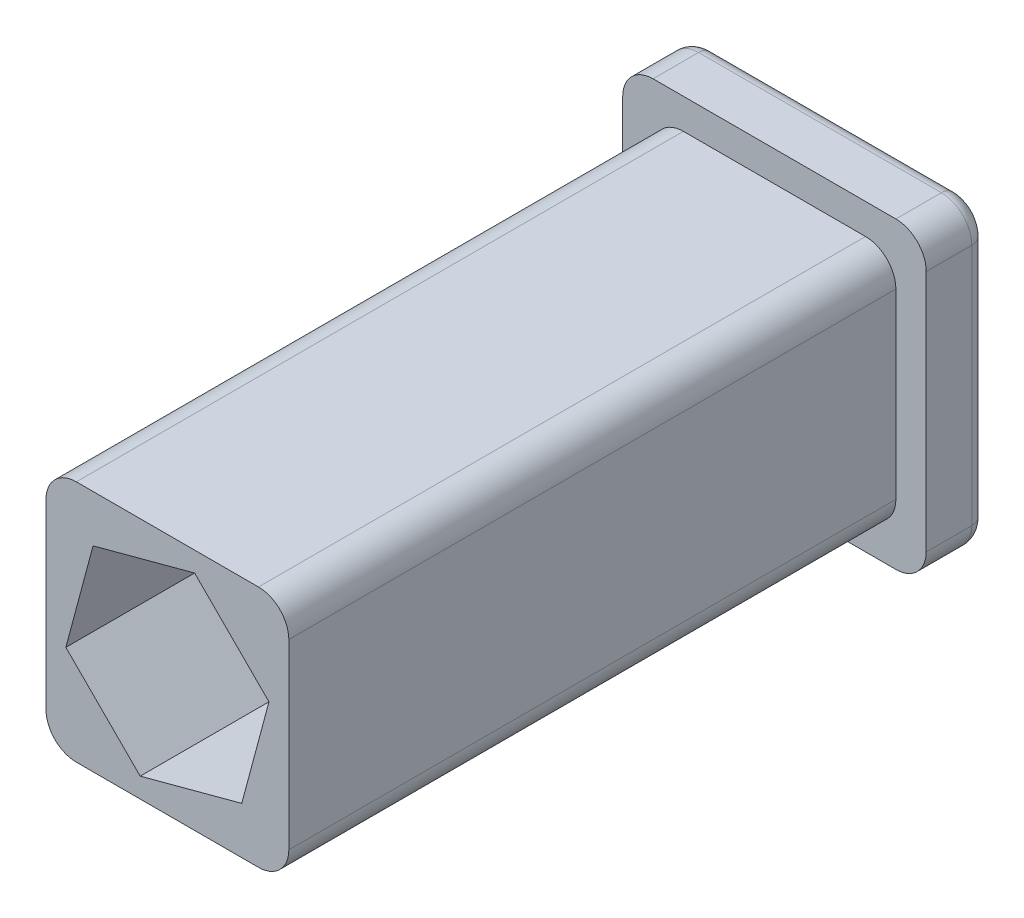
from build123d import *

# Parameters (mm, degrees)
SKETCH1_W            = 10
SKETCH1_H            = 10
BOSS_EXTRUDE1_DEPTH  = 2
FILLET2_R            = 1
FILLET3_R            = 1
FILLET5_R            = 0.5
SKETCH6_W            = 8
SKETCH6_H            = 8
BOSS_EXTRUDE2_DEPTH  = 20
FILLET7_R            = 1
M3_CLEARANCE_HOLE1_D = 3.4
CUT_EXTRUDE1_DEPTH   = 20


with BuildPart() as part:
    # Sketch1 → Boss-Extrude1 (new body)
    with BuildSketch(Plane.XY):
        with Locations((-9.082568807, 1.399082569)):
            Rectangle(SKETCH1_W, SKETCH1_H)
    extrude(amount=BOSS_EXTRUDE1_DEPTH)

    # Fillet2
    fillet2_edges = [part.edges().sort_by_distance(p)[0] for p in [
        (-14.082568807, 6.399082569, 1),
        (-4.082568807, 6.399082569, 1),
        (-14.082568807, -3.600917431, 1),
    ]]
    fillet(fillet2_edges, radius=FILLET2_R)

    # Fillet3
    fillet3_edges = [part.edges().sort_by_distance(p)[0] for p in [
        (-4.082568807, -3.600917431, 1),
    ]]
    fillet(fillet3_edges, radius=FILLET3_R)

    # Fillet5
    fillet5_edges = [part.edges().sort_by_distance(p)[0] for p in [
        (-9.082568807, 6.399082569, 0),
        (-14.082568807, 1.399082569, 0),
        (-9.082568807, -3.600917431, 0),
        (-13.789675589, -3.308024212, 0),
        (-13.789675589, 6.10618935, 0),
        (-4.375462026, 6.10618935, 0),
        (-4.082568807, 1.399082569, 0),
        (-4.375462026, -3.308024212, 0),
    ]]
    fillet(fillet5_edges, radius=FILLET5_R)

    # Sketch6 → Boss-Extrude2 (add)
    with BuildSketch(Plane.XY.offset(2)):
        with Locations((-9.082568807, 1.399082569)):
            Rectangle(SKETCH6_W, SKETCH6_H)
    extrude(amount=BOSS_EXTRUDE2_DEPTH)

    # Fillet7
    fillet7_edges = [part.edges().sort_by_distance(p)[0] for p in [
        (-13.082568807, 5.399082569, 12),
        (-13.082568807, -2.600917431, 12),
        (-5.082568807, -2.600917431, 12),
        (-5.082568807, 5.399082569, 12),
    ]]
    fillet(fillet7_edges, radius=FILLET7_R)

    # M3 Clearance Hole1 (through all)
    with Locations(Plane(origin=(0, 0, 0), x_dir=(-1, 0, 0), z_dir=(0, 0, -1))):
        with Locations((9.082568807, 1.399082569)):
            Hole(M3_CLEARANCE_HOLE1_D / 2)

    # Sketch7 → Cut-Extrude1 (cut)
    with BuildSketch(Plane.XY.offset(22)):
        Polygon((-6.633079065, -1.050407174), (-5.736503592, 2.295658041), (-8.185993335, 4.745147784), (-11.53205855, 3.848572312), (-12.428634022, 0.502507097), (-9.97914428, -1.946982646), align=None)
    extrude(amount=-CUT_EXTRUDE1_DEPTH, mode=Mode.SUBTRACT)


solid = part.part
